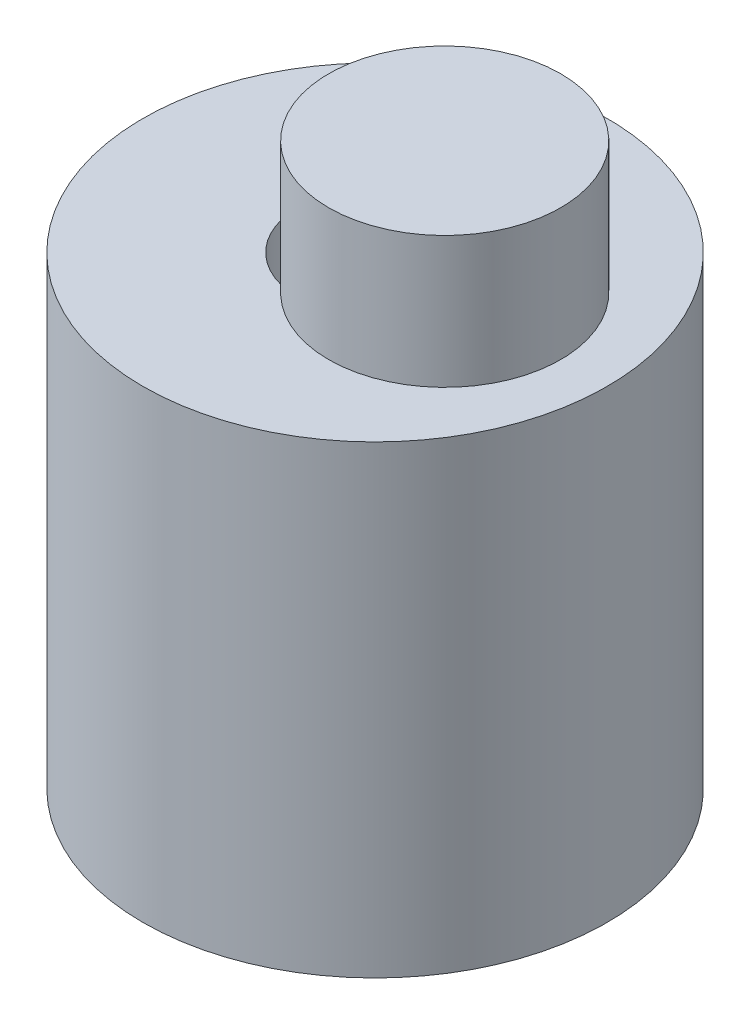
from build123d import *

# Parameters (mm, degrees)
SKETCH1_R           = 3
SKETCH1_R_2         = 1
BOSS_EXTRUDE1_DEPTH = 6
SKETCH2_R           = 1.5
BOSS_EXTRUDE2_DEPTH = 1.7


with BuildPart() as part:
    # Sketch1 → Boss-Extrude1 (new body)
    with BuildSketch(Plane(origin=(0, 0, 0), x_dir=(1, 0, 0), z_dir=(0, 1, 0))):
        with Locations(Location((0, 0, 0), (0, 0, 270))):
            Circle(SKETCH1_R)
        with Locations(Location((0, 0, 0), (0, 0, 270))):
            Circle(SKETCH1_R_2, mode=Mode.SUBTRACT)
    extrude(amount=BOSS_EXTRUDE1_DEPTH)

    # Sketch2 → Boss-Extrude2 (add)
    with BuildSketch(Plane(origin=(0, 6, 0), x_dir=(1, 0, 0), z_dir=(0, 1, 0))):
        with Locations(Location((0.9, 0, 0), (0, 0, 139.72610706))):
            Circle(SKETCH2_R)
    extrude(amount=BOSS_EXTRUDE2_DEPTH)


solid = part.part
